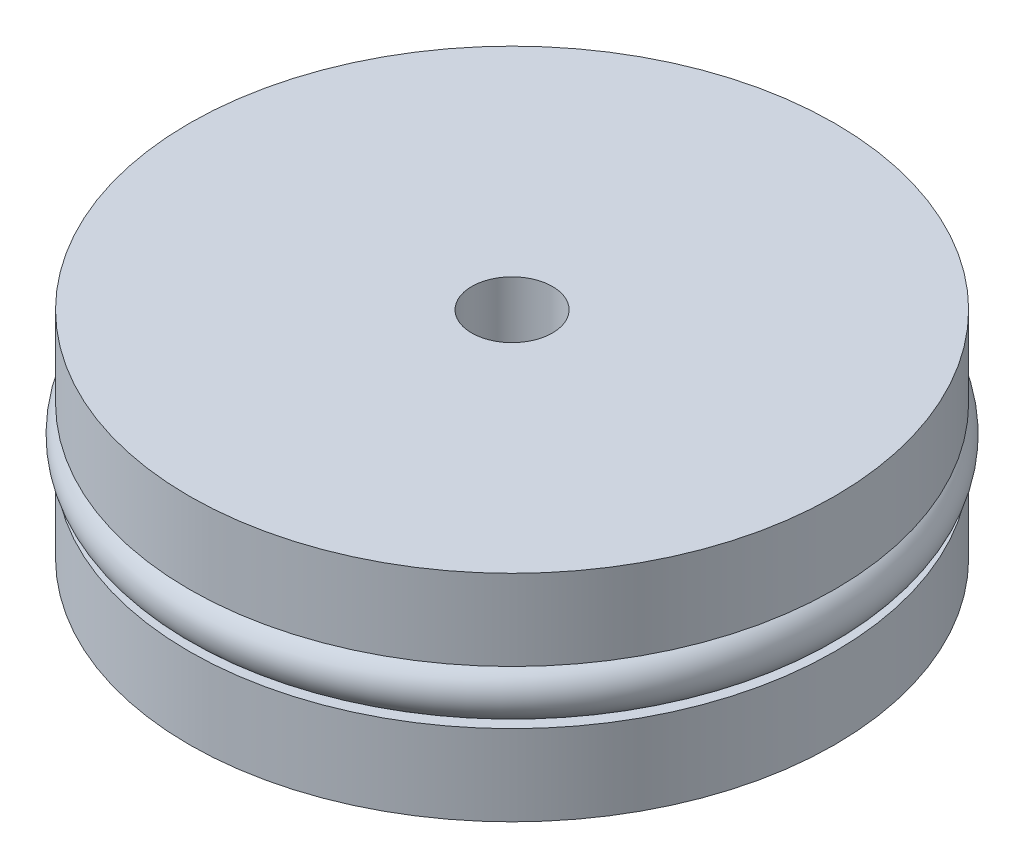
from build123d import *

# Parameters (mm, degrees)
SKETCH1_R           = 12
BOSS_EXTRUDE1_DEPTH = 4
SKETCH2_R           = 12
SKETCH2_R_2         = 10.25
CUT_EXTRUDE1_DEPTH  = 1
SKETCH3_R           = 1
SKETCH4_R           = 1.5
CUT_EXTRUDE2_DEPTH  = 20.082059766


with BuildPart() as part:
    # Sketch1 → Boss-Extrude1 (new, symmetric)
    with BuildSketch(Plane(origin=(0, 0, 0), x_dir=(1, 0, 0), z_dir=(0, 1, 0))):
        with Locations(Location((0, 0, 0), (0, 0, 270))):
            Circle(SKETCH1_R)
    extrude(amount=BOSS_EXTRUDE1_DEPTH, both=True)

    # Sketch2 → Cut-Extrude1 (cut, symmetric)
    with BuildSketch(Plane(origin=(0, 0, 0), x_dir=(1, 0, 0), z_dir=(0, 1, 0))):
        with Locations(Location((0, 0, 0), (0, 0, 270))):
            Circle(SKETCH2_R)
        with Locations(Location((0, 0, 0), (0, 0, 270))):
            Circle(SKETCH2_R_2, mode=Mode.SUBTRACT)
    extrude(amount=CUT_EXTRUDE1_DEPTH, both=True, mode=Mode.SUBTRACT)

    # Sketch4 → Cut-Extrude2 (cut, through all)
    with BuildSketch(Plane(origin=(0, 4, 0), x_dir=(1, 0, 0), z_dir=(0, 1, 0))):
        with Locations(Location((0, 0, 0), (0, 0, 270))):
            Circle(SKETCH4_R)
    extrude(amount=-CUT_EXTRUDE2_DEPTH, mode=Mode.SUBTRACT)


with BuildPart() as body_2:
    # Sketch3 → Revolve1 (revolve)
    with BuildSketch(Plane.XY):
        with Locations((-11.25, 0)):
            Circle(SKETCH3_R)
    revolve(axis=Axis((0, 4, 0), (0, -1, 0)))


solid = Compound([part.part, body_2.part])
